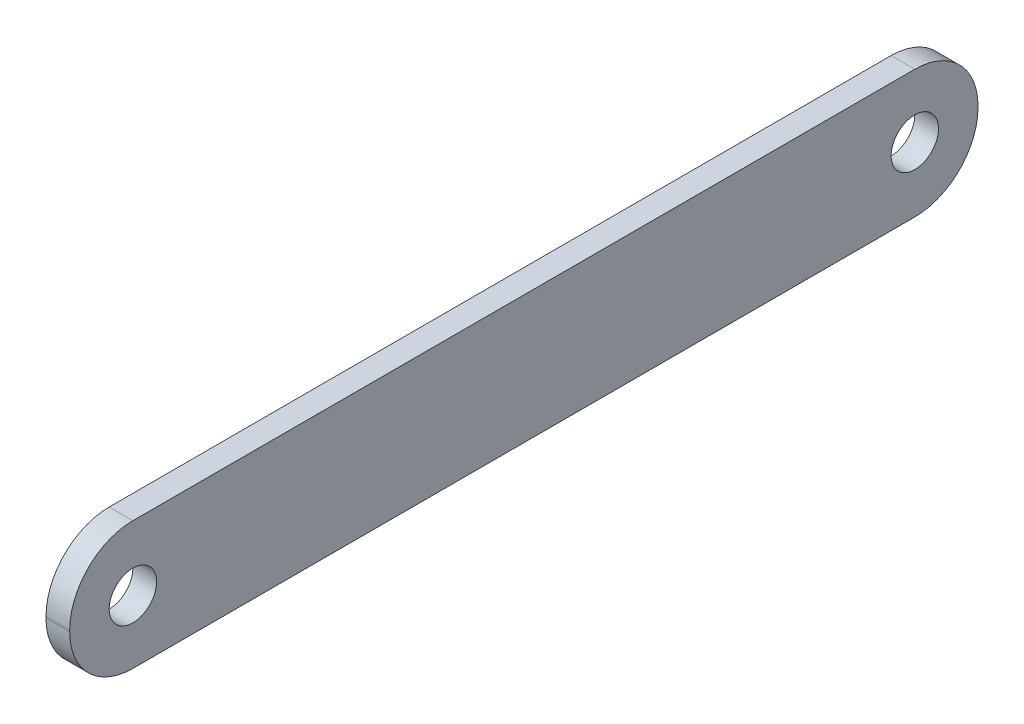
from build123d import *

# Parameters (mm, degrees)
SKETCH1_R           = 3
BOSS_EXTRUDE1_DEPTH = 3


with BuildPart() as part:
    # Sketch1 → Boss-Extrude1 (new body)
    with BuildSketch(Plane(origin=(0, 0, 0), x_dir=(0, 0, -1), z_dir=(1, 0, 0))):
        with BuildLine():
            Line((-49.5, 8.1), (49.5, 8.1))
            ThreePointArc((49.5, 8.1), (55.156854249, 5.756854249), (57.5, 0.1))
            Line((57.5, 0.1), (57.5, -0.1))
            ThreePointArc((57.5, -0.1), (55.156854249, -5.756854249), (49.5, -8.1))
            Line((49.5, -8.1), (-49.5, -8.1))
            ThreePointArc((-49.5, -8.1), (-55.156854249, -5.756854249), (-57.5, -0.1))
            Line((-57.5, -0.1), (-57.5, 0.1))
            ThreePointArc((-57.5, 0.1), (-55.156854249, 5.756854249), (-49.5, 8.1))
        make_face()
        with Locations((-49.5, -0.1)):
            Circle(SKETCH1_R, mode=Mode.SUBTRACT)
        with Locations((49.5, 0.1)):
            Circle(SKETCH1_R, mode=Mode.SUBTRACT)
    extrude(amount=BOSS_EXTRUDE1_DEPTH)


solid = part.part
